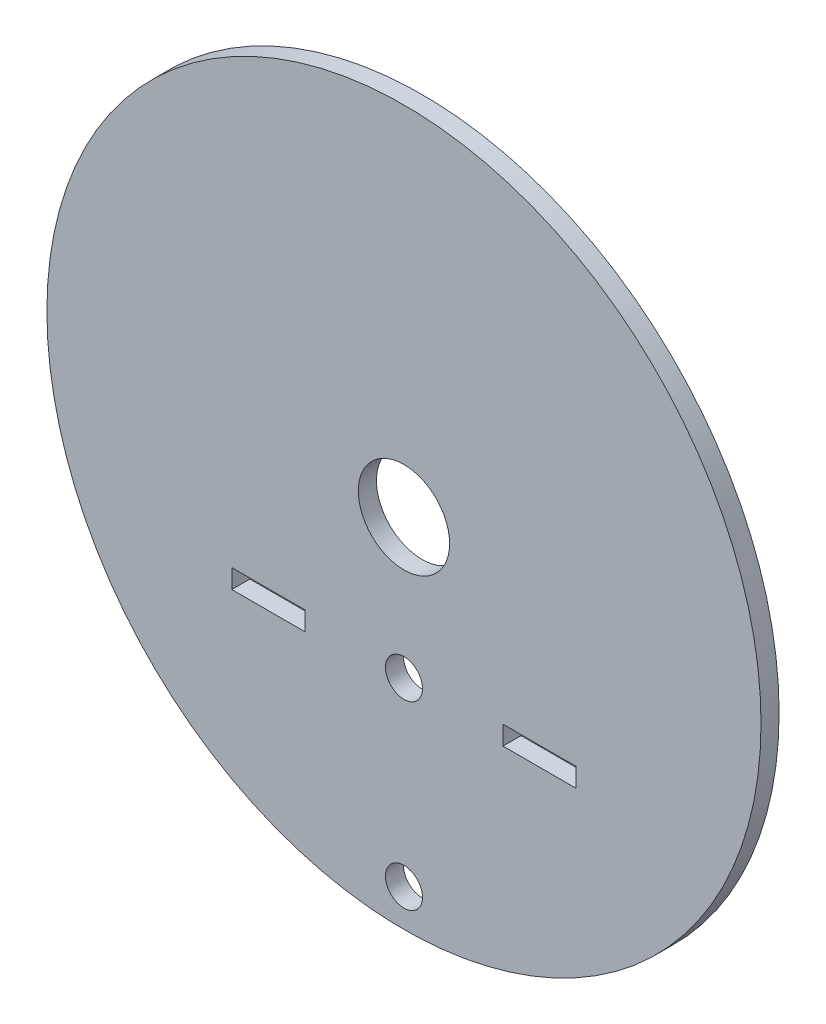
from build123d import *

# Parameters (mm, degrees)
SKETCH_1_R      = 39.5
SKETCH_1_R_2    = 2.05
SKETCH_1_R_3    = 5.05
SKETCH_1_W      = 8.1
SKETCH_1_H      = 2.1
EXTRUDE_1_DEPTH = 2


with BuildPart() as part:
    # 草图1 → 凸台-拉伸1 (new body)
    with BuildSketch(Plane.XY):
        with Locations((0, 35.4)):
            Circle(SKETCH_1_R)
        Circle(SKETCH_1_R_2, mode=Mode.SUBTRACT)
        with Locations((0, 20)):
            Circle(SKETCH_1_R_2, mode=Mode.SUBTRACT)
        with Locations((0, 35.4)):
            Circle(SKETCH_1_R_3, mode=Mode.SUBTRACT)
        with Locations((-15, 20)):
            Rectangle(SKETCH_1_W, SKETCH_1_H, mode=Mode.SUBTRACT)
        with Locations((15, 20)):
            Rectangle(SKETCH_1_W, SKETCH_1_H, mode=Mode.SUBTRACT)
    extrude(amount=EXTRUDE_1_DEPTH)


solid = part.part
